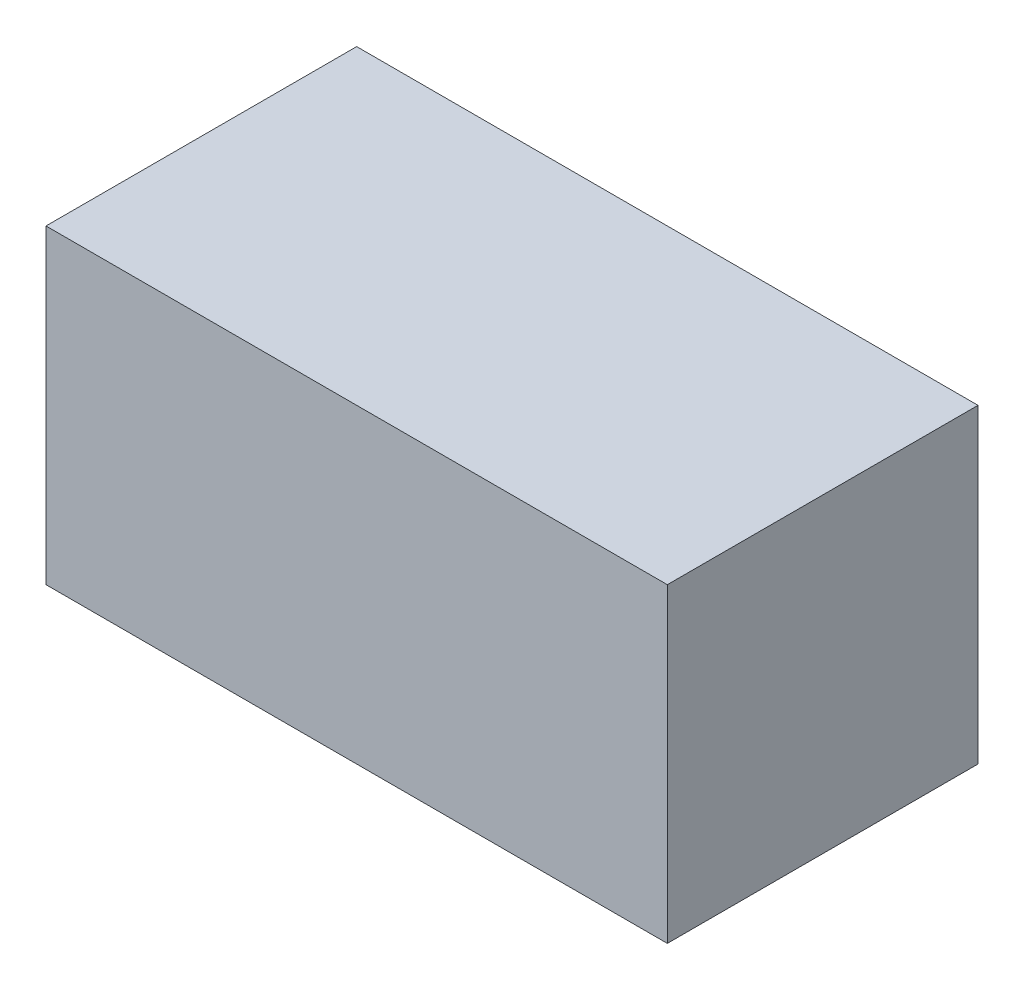
from build123d import *

# Parameters (mm, degrees)
SKETCH1_W           = 304.8
SKETCH1_H           = 152.4
BOSS_EXTRUDE1_DEPTH = 152.4


with BuildPart() as part:
    # Sketch1 → Boss-Extrude1 (new body)
    with BuildSketch(Plane(origin=(0, 0, 0), x_dir=(1, 0, 0), z_dir=(0, 1, 0))):
        with Locations((-152.4, 76.2)):
            Rectangle(SKETCH1_W, SKETCH1_H)
    extrude(amount=BOSS_EXTRUDE1_DEPTH)


solid = part.part
